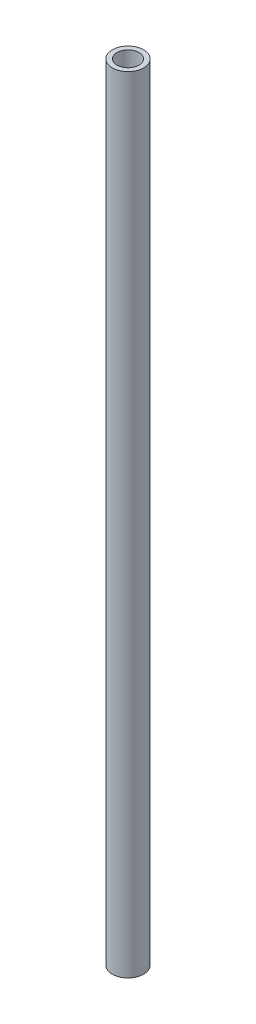
from build123d import *

# Parameters (mm, degrees)
SKETCH1_R           = 5
SKETCH1_R_2         = 3.5
BOSS_EXTRUDE1_DEPTH = 250


with BuildPart() as part:
    # Sketch1 → Boss-Extrude1 (new body)
    with BuildSketch(Plane(origin=(0, 0, 0), x_dir=(1, 0, 0), z_dir=(0, 1, 0))):
        with Locations(Location((0, 0, 0), (0, 0, 270))):
            Circle(SKETCH1_R)
        with Locations(Location((0, 0, 0), (0, 0, 270))):
            Circle(SKETCH1_R_2, mode=Mode.SUBTRACT)
    extrude(amount=BOSS_EXTRUDE1_DEPTH)


solid = part.part
